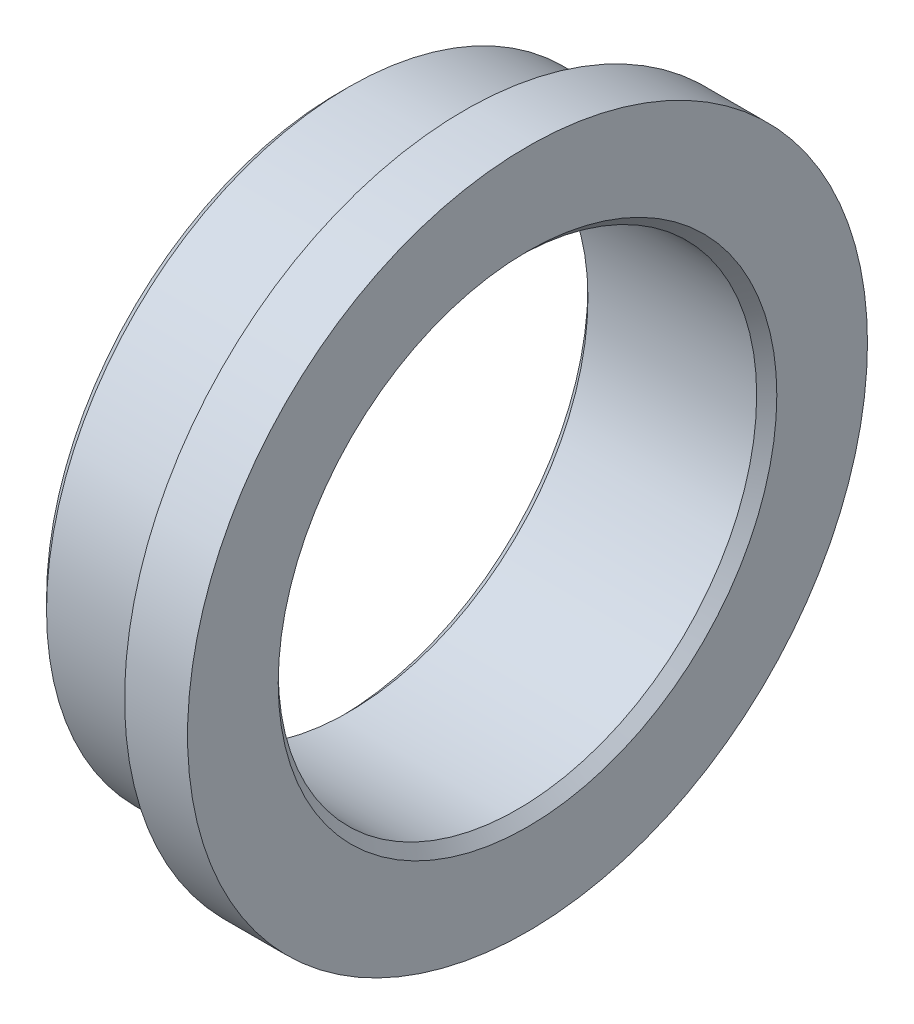
from build123d import *

# Parameters (mm, degrees)
FASE1_SIZE = 0.8


with BuildPart() as part:
    # Skizze1 → Rotation1 (revolve)
    with BuildSketch(Plane.XY, mode=Mode.PRIVATE) as rotation1_sk:
        Polygon((-2, 24), (-10, 24), (-10, 19), (5, 19), (5, 27), (0, 27), (0, 25.369078951), (0, 23.8), (-2, 23.8), align=None)
    revolve(rotation1_sk.sketch.rotate(Axis((6.5, 0, 0), (-1, 0, 0)), 90), axis=Axis((6.5, 0, 0), (-1, 0, 0)))

    # Fase1
    fase1_edges = [part.edges().sort_by_distance(p)[0] for p in [
        (-10, 0, 24),
        (-10, 0, 19),
        (5, 0, 19),
    ]]
    chamfer(fase1_edges, length=FASE1_SIZE)


solid = part.part
